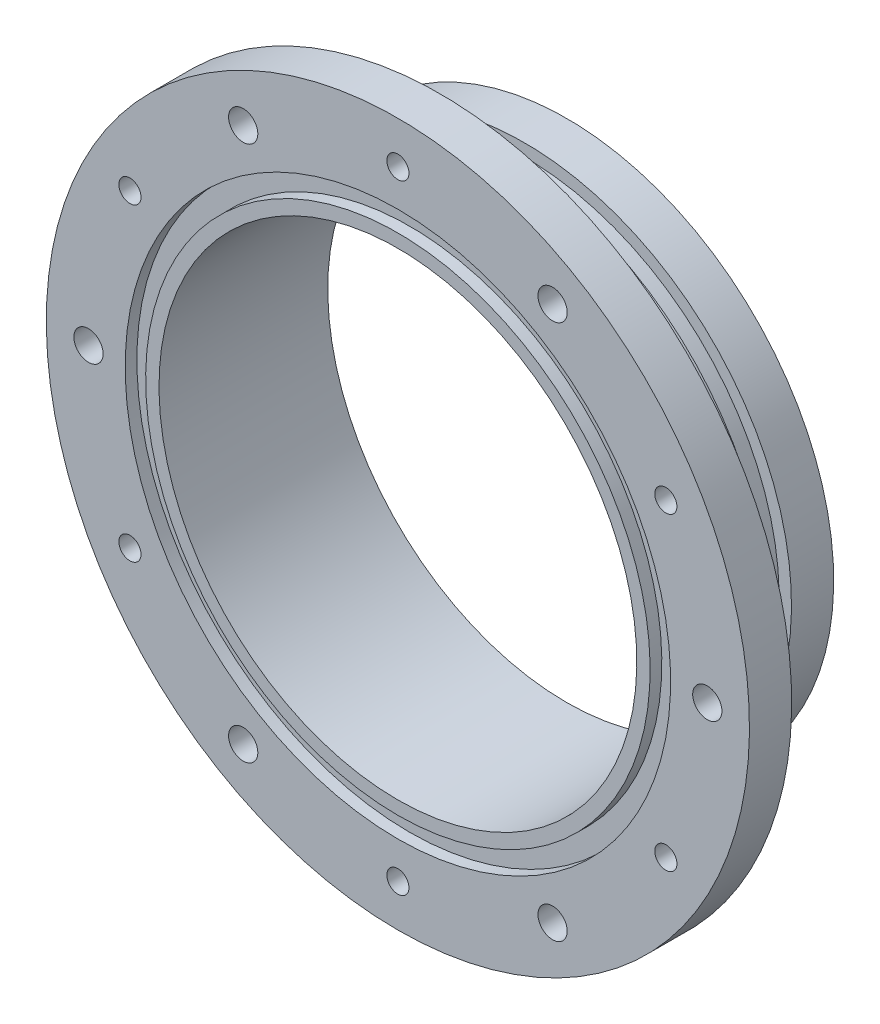
from build123d import *

# Parameters (mm, degrees)
SKETCH1_W            = 2.6416
SKETCH1_H            = 4.6228
SKETCH1_W_2          = 9.525
SKETCH1_H_2          = 53.9369
SKETCH1_4_W          = 9.525
SKETCH1_4_H          = 53.9369
SKETCH1_4_W_2        = 2.6416
SKETCH1_4_H_2        = 4.6228
M6_TAPPED_HOLE1_D    = 5
M6_CLEARANCE_HOLE1_D = 6.6


with BuildPart() as part:
    # Sketch1 → Revolve1 (revolve)
    with BuildSketch(Plane(origin=(0, 0, 0), x_dir=(0, 0, -1), z_dir=(1, 0, 0)), mode=Mode.PRIVATE) as revolve1_sk:
        Polygon((0, 61.5696), (0, 79.375), (9.525, 79.375), (9.525, 60.2869), (13.97, 60.2869), (13.97, 57.5056), (19.05, 57.5056), (19.05, 60.2869), (23.495, 60.2869), (23.495, 57.5056), (28.575, 57.5056), (28.575, 60.2869), (38.1, 60.2869), (38.1, 53.9369), (9.525, 53.9369), (0, 53.9369), (0, 56.9468), (2.6416, 56.9468), (2.6416, 61.5696), align=None)
        with Locations((1.3208, 59.2582)):
            Rectangle(SKETCH1_W, SKETCH1_H)
        with Locations((4.7625, 26.96845)):
            Rectangle(SKETCH1_W_2, SKETCH1_H_2)
    revolve(revolve1_sk.sketch.rotate(Axis((0, 0, 0), (0, 0, -1)), 180), axis=Axis((0, 0, 0), (0, 0, -1)))

    # Sketch1<4> → Cut-Revolve1 (revolve, cut)
    with BuildSketch(Plane(origin=(0, 0, 0), x_dir=(0, 0, -1), z_dir=(1, 0, 0)), mode=Mode.PRIVATE) as cut_revolve1_sk:
        with Locations((4.7625, 26.96845)):
            Rectangle(SKETCH1_4_W, SKETCH1_4_H)
        with Locations((1.3208, 59.2582)):
            Rectangle(SKETCH1_4_W_2, SKETCH1_4_H_2)
    revolve(cut_revolve1_sk.sketch.rotate(Axis((0, 0, 0), (0, 0, -1)), 180), axis=Axis((0, 0, 0), (0, 0, -1)), mode=Mode.SUBTRACT)

    # M6 Tapped Hole1 (through all)
    with Locations(Plane.XY):
        with Locations((-60.491874454, 34.925), (0, 69.85), (60.491874454, 34.925), (60.491874454, -34.925), (0, -69.85), (-60.491874454, -34.925)):
            Hole(M6_TAPPED_HOLE1_D / 2)

    # M6 Clearance Hole1 (through all)
    with Locations(Plane.XY):
        with Locations((-69.85, 0), (0, 0), (-34.925, 60.491874454), (34.925, 60.491874454), (69.85, 0), (34.925, -60.491874454), (-34.925, -60.491874454)):
            Hole(M6_CLEARANCE_HOLE1_D / 2)


solid = part.part
